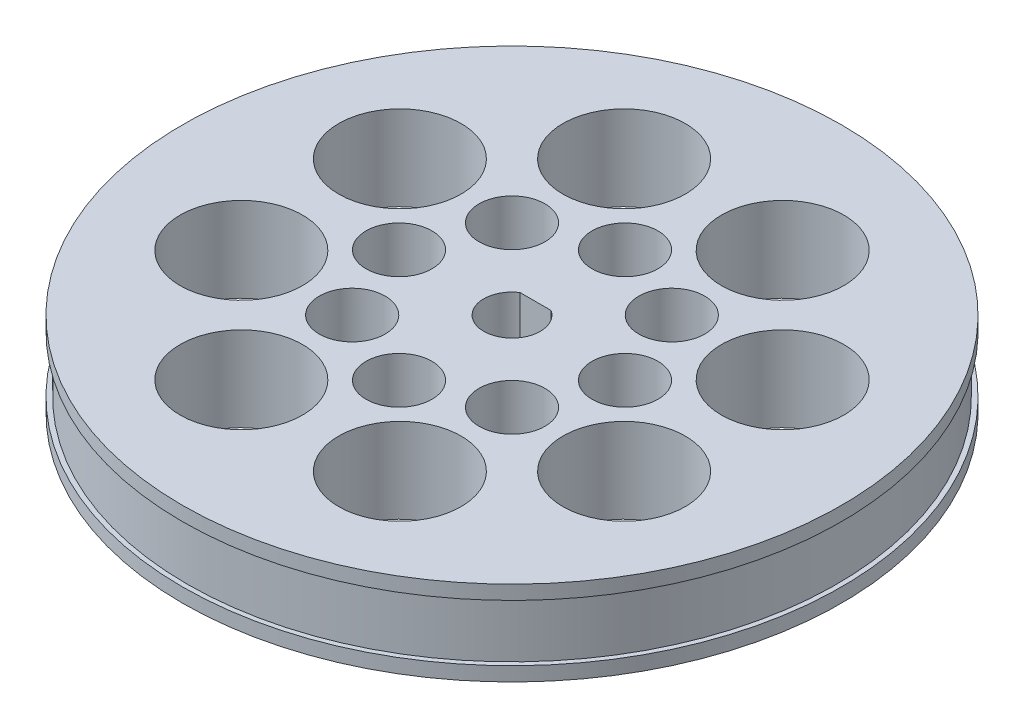
from build123d import *

# Parameters (mm, degrees)
SKETCH_1_R               = 35
EXTRUDE_1_DEPTH          = 9
CUT_EXTRUDE_1_DEPTH      = 51.309044912
CUT_EXTRUDE_1_DEPTH_BACK = 51.309044912
CUT_EXTRUDE_2_DEPTH      = 51.309044912
CUT_EXTRUDE_2_DEPTH_BACK = 51.309044912
SKETCH_3_R               = 3.5
SKETCH_3_R_2             = 6.5
SKETCH_4_W               = 1
SKETCH_4_H               = 6


with BuildPart() as part:
    # 스케치1 → 보스-돌출1 (new body)
    with BuildSketch(Plane(origin=(0, 0, 0), x_dir=(1, 0, 0), z_dir=(0, 1, 0))):
        with Locations(Location((0, 0, 0), (0, 0, 270))):
            Circle(SKETCH_1_R)
    extrude(amount=EXTRUDE_1_DEPTH)

    # 스케치2 → 컷-돌출1 (cut, two sides: drawn at the far end of the back side and taken through both)
    with BuildSketch(Plane(origin=(0, 9, 0), x_dir=(1, 0, 0), z_dir=(0, 1, 0)).offset(-CUT_EXTRUDE_1_DEPTH_BACK)):
        with BuildLine():
            Line((-1.658312395, 2.5), (1.658312395, 2.5))
            ThreePointArc((1.658312395, 2.5), (0, -3), (-1.658312395, 2.5))
        make_face()
    extrude(amount=CUT_EXTRUDE_1_DEPTH + CUT_EXTRUDE_1_DEPTH_BACK, mode=Mode.SUBTRACT)

    # 스케치3 → 컷-돌출2 (cut, two sides: drawn at the far end of the back side and taken through both)
    with BuildSketch(Plane(origin=(0, 9, 0), x_dir=(1, 0, 0), z_dir=(0, 1, 0)).offset(-CUT_EXTRUDE_2_DEPTH_BACK)):
        with Locations(Location((8.485281374, -8.485281374, 0), (0, 0, 270))):
            Circle(SKETCH_3_R)
        with Locations(Location((8.419035512, -20.325349715, 0), (0, 0, 270))):
            Circle(SKETCH_3_R_2)
        with Locations(Location((-8.419035512, -20.325349715, 0), (0, 0, 270))):
            Circle(SKETCH_3_R_2)
        with Locations(Location((0, -12, 0), (0, 0, 270))):
            Circle(SKETCH_3_R)
        with Locations(Location((-20.325349715, -8.419035512, 0), (0, 0, 270))):
            Circle(SKETCH_3_R_2)
        with Locations(Location((-8.485281374, -8.485281374, 0), (0, 0, 270))):
            Circle(SKETCH_3_R)
        with Locations(Location((-20.325349715, 8.419035512, 0), (0, 0, 270))):
            Circle(SKETCH_3_R_2)
        with Locations(Location((-12, 0, 0), (0, 0, 270))):
            Circle(SKETCH_3_R)
        with Locations(Location((-8.419035512, 20.325349715, 0), (0, 0, 270))):
            Circle(SKETCH_3_R_2)
        with Locations(Location((-8.485281374, 8.485281374, 0), (0, 0, 270))):
            Circle(SKETCH_3_R)
        with Locations(Location((8.419035512, 20.325349715, 0), (0, 0, 270))):
            Circle(SKETCH_3_R_2)
        with Locations(Location((0, 12, 0), (0, 0, 270))):
            Circle(SKETCH_3_R)
        with Locations(Location((20.325349715, 8.419035512, 0), (0, 0, 270))):
            Circle(SKETCH_3_R_2)
        with Locations(Location((8.485281374, 8.485281374, 0), (0, 0, 270))):
            Circle(SKETCH_3_R)
        with Locations(Location((20.325349715, -8.419035512, 0), (0, 0, 270))):
            Circle(SKETCH_3_R_2)
        with Locations(Location((12, 0, 0), (0, 0, 270))):
            Circle(SKETCH_3_R)
    extrude(amount=CUT_EXTRUDE_2_DEPTH + CUT_EXTRUDE_2_DEPTH_BACK, mode=Mode.SUBTRACT)

    # 스케치4 → 컷-회전1 (revolve, cut)
    with BuildSketch(Plane(origin=(0, 0, 0), x_dir=(0, 0, -1), z_dir=(1, 0, 0)), mode=Mode.PRIVATE) as cut_revolve_1_sk:
        with Locations((35, 4.5)):
            Rectangle(SKETCH_4_W, SKETCH_4_H)
    revolve(cut_revolve_1_sk.sketch.rotate(Axis((0, 9, 0), (0, -1, 0)), 180), axis=Axis((0, 9, 0), (0, -1, 0)), mode=Mode.SUBTRACT)


solid = part.part
